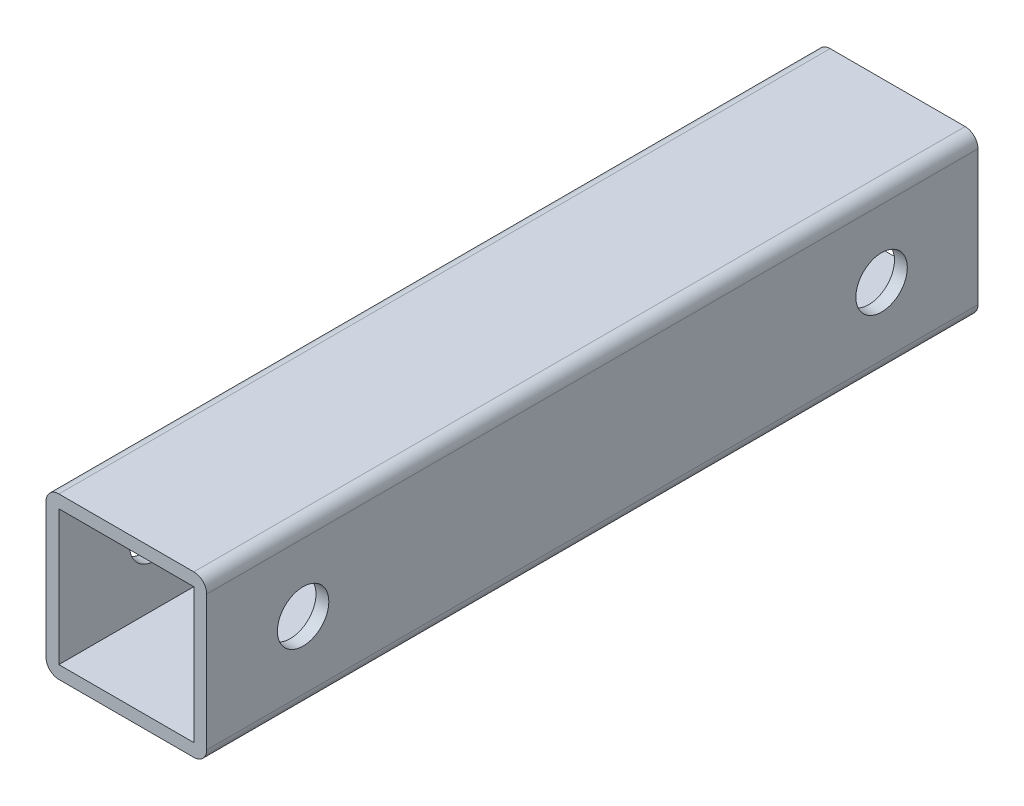
from build123d import *

# Parameters (mm, degrees)
EXTRUDE_THIN1_DEPTH      = 60
EXTRUDE_THIN1_DEPTH_BACK = 60
SKETCH1_W                = 25
SKETCH1_H                = 25
SKETCH1_W_2              = 21
SKETCH1_H_2              = 21
FILLET1_R                = 2
SKETCH2_R                = 4
CUT_EXTRUDE1_DEPTH       = 67.191011474


with BuildPart() as part:
    # Sketch1 → Extrude-Thin1 (new, two sides: drawn at the far end of the back side and taken through both)
    with BuildSketch(Plane.XY.offset(-EXTRUDE_THIN1_DEPTH_BACK)):
        Rectangle(SKETCH1_W, SKETCH1_H)
        Rectangle(SKETCH1_W_2, SKETCH1_H_2, mode=Mode.SUBTRACT)
    extrude(amount=EXTRUDE_THIN1_DEPTH + EXTRUDE_THIN1_DEPTH_BACK)

    # Fillet1
    fillet1_edges = [part.edges().sort_by_distance(p)[0] for p in [
        (12.5, -12.5, 0),
        (-12.5, -12.5, 0),
        (-12.5, 12.5, 0),
        (12.5, 12.5, 0),
    ]]
    fillet(fillet1_edges, radius=FILLET1_R)

    # Sketch2 → Cut-Extrude1 (cut, through all)
    with BuildSketch(Plane(origin=(12.5, 0, 0), x_dir=(0, 0, -1), z_dir=(1, 0, 0))):
        with Locations((-45, 0)):
            Circle(SKETCH2_R)
        with Locations((45, 0)):
            Circle(SKETCH2_R)
    extrude(amount=-CUT_EXTRUDE1_DEPTH, mode=Mode.SUBTRACT)


solid = part.part
